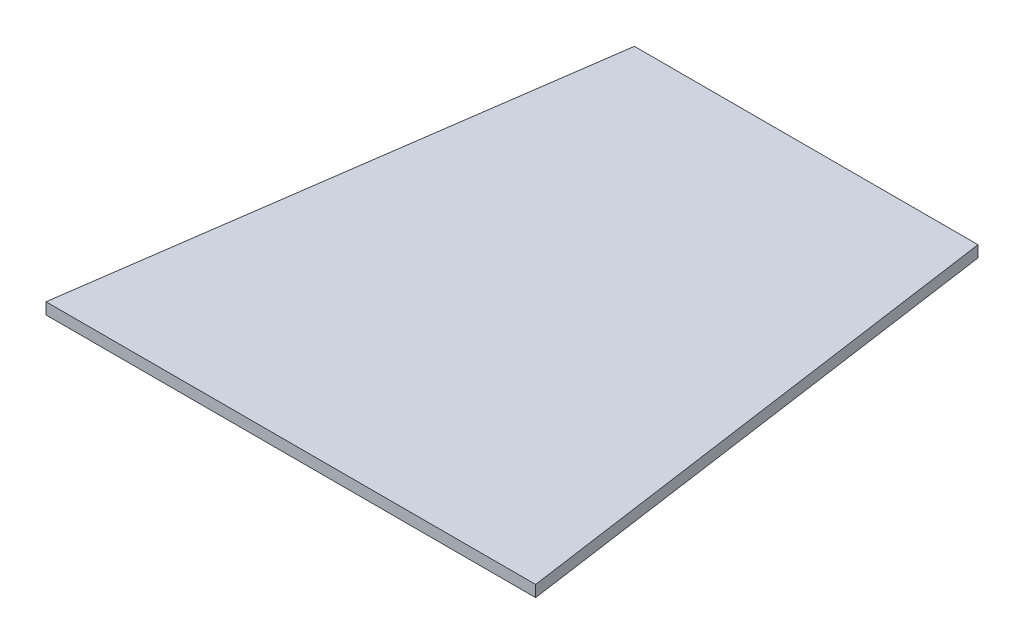
from build123d import *

# Parameters (mm, degrees)
EXTRUDE_1_DEPTH = 2


with BuildPart() as part:
    # 草图1 → 凸台-拉伸1 (new body)
    with BuildSketch(Plane(origin=(0, 0, 0), x_dir=(1, 0, 0), z_dir=(0, 1, 0))):
        Polygon((30, 90), (-30, 90), (-42.75, 0), (42.75, 0), align=None)
    extrude(amount=EXTRUDE_1_DEPTH)


solid = part.part
